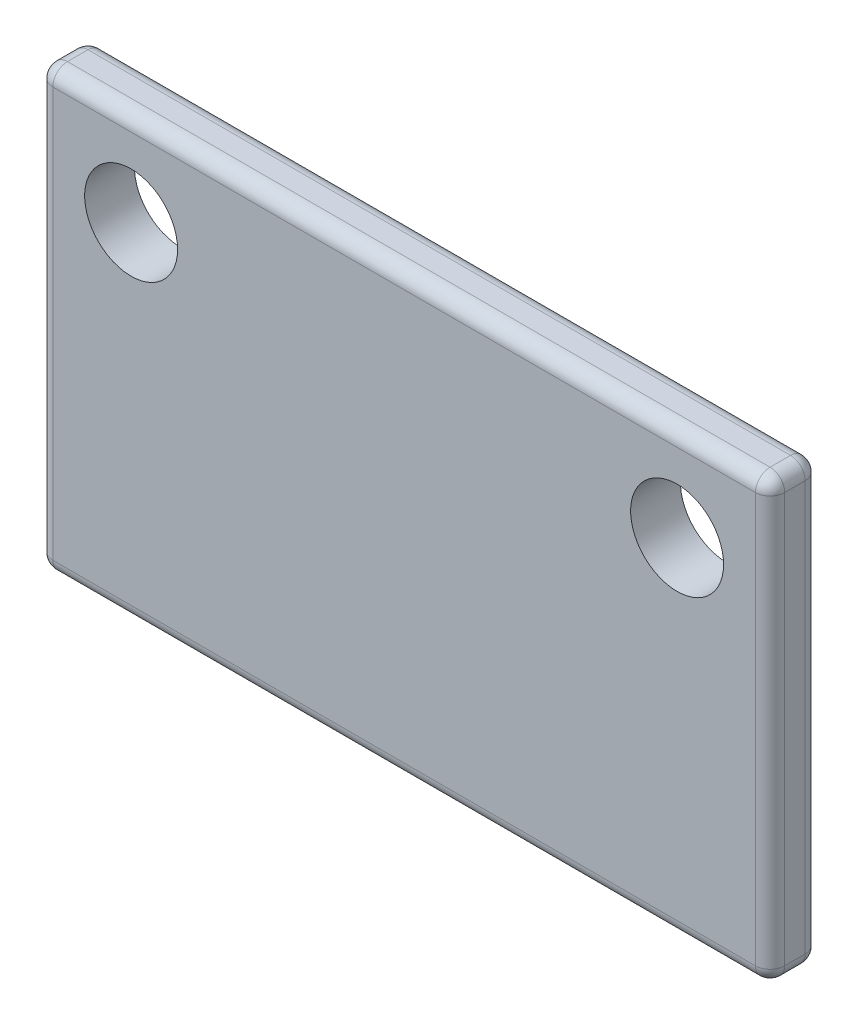
from build123d import *

# Parameters (mm, degrees)
ESBO_O1_W                = 25
ESBO_O1_H                = 15
RESSALTO_EXTRUS_O1_DEPTH = 1.7
ESBO_O2_R                = 1.5875
CORTE_EXTRUS_O1_DEPTH    = 15.676171163
FILETE2_R                = 0.5


with BuildPart() as part:
    # Esboço1 → Ressalto-extrusão1 (new body)
    with BuildSketch(Plane.XY):
        Rectangle(ESBO_O1_W, ESBO_O1_H)
    extrude(amount=RESSALTO_EXTRUS_O1_DEPTH)

    # Esboço2 → Corte-extrusão1 (cut, through all)
    with BuildSketch(Plane.XY.offset(1.7)):
        with Locations((-9.325, 4.325)):
            Circle(ESBO_O2_R)
        with Locations((9.325, 4.325)):
            Circle(ESBO_O2_R)
    extrude(amount=-CORTE_EXTRUS_O1_DEPTH, mode=Mode.SUBTRACT)

    # Filete2
    filete2_edges = [part.edges().sort_by_distance(p)[0] for p in [
        (12.5, 0, 1.7),
        (0, 7.5, 1.7),
        (-12.5, 0, 1.7),
        (0, 7.5, 0),
        (12.5, 0, 0),
        (0, -7.5, 0),
        (-12.5, 0, 0),
        (0, -7.5, 1.7),
        (-12.5, 7.5, 0.85),
        (12.5, 7.5, 0.85),
        (12.5, -7.5, 0.85),
        (-12.5, -7.5, 0.85),
    ]]
    fillet(filete2_edges, radius=FILETE2_R)


solid = part.part
